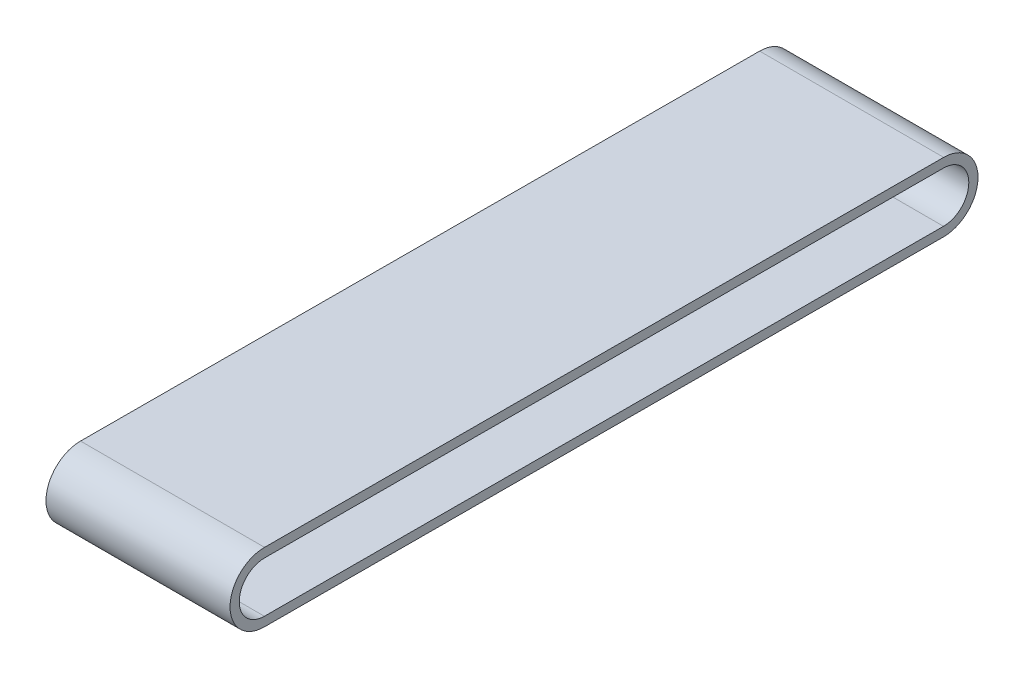
from build123d import *

# Parameters (mm, degrees)
EXTRUDE_THIN1_DEPTH = 50.8


with BuildPart() as part:
    # Sketch1 → Extrude-Thin1 (new, symmetric)
    with BuildSketch(Plane(origin=(0, 0, 0), x_dir=(0, 0, -1), z_dir=(1, 0, 0))):
        with BuildLine():
            Line((739.445486489, 99.26251427), (364.541486489, 100.27851427))
            ThreePointArc((364.541486489, 100.27851427), (345.49148573, 81.331486489), (364.438513511, 62.28148573))
            Line((364.438513511, 62.28148573), (739.342513511, 61.26548573))
            ThreePointArc((739.342513511, 61.26548573), (758.39251427, 80.212513511), (739.445486489, 99.26251427))
        make_face()
        with BuildLine():
            Line((739.431719601, 94.182532924), (364.527719601, 95.198532924))
            ThreePointArc((364.527719601, 95.198532924), (350.571467076, 81.317719601), (364.452280399, 67.361467076))
            Line((364.452280399, 67.361467076), (739.356280399, 66.345467076))
            ThreePointArc((739.356280399, 66.345467076), (753.312532924, 80.226280399), (739.431719601, 94.182532924))
        make_face(mode=Mode.SUBTRACT)
    extrude(amount=EXTRUDE_THIN1_DEPTH, both=True)


solid = part.part
